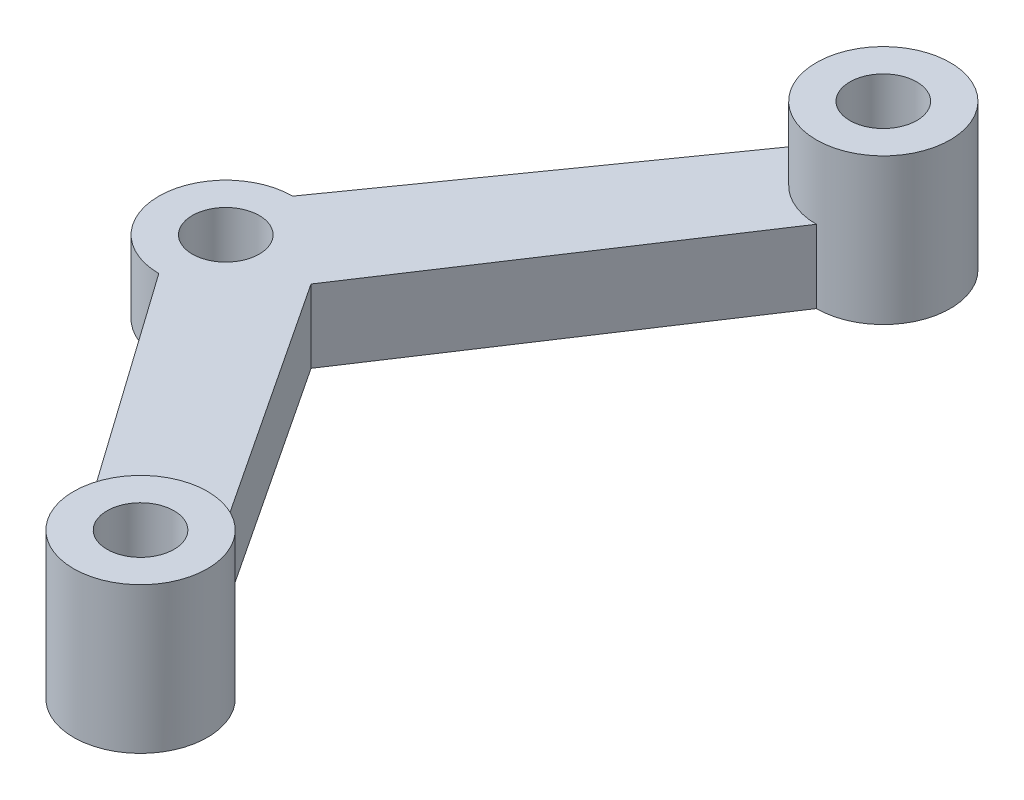
from build123d import *

# Parameters (mm, degrees)
SKETCH2_R           = 1.375
BOSS_EXTRUDE1_DEPTH = 3
SKETCH3_R           = 2.75
SKETCH3_R_2         = 1.375
BOSS_EXTRUDE2_DEPTH = 3


with BuildPart() as part:
    # Sketch2 → Boss-Extrude1 (new body)
    with BuildSketch(Plane(origin=(0, 0, 0), x_dir=(1, 0, 0), z_dir=(0, 1, 0))):
        with BuildLine():
            Line((-27, -2.75), (-17.987773433, -15.509030166))
            ThreePointArc((-17.987773433, -15.509030166), (-13.21593597, -17.100698117), (-15.25, -12.5))
            Line((-15.25, -12.5), (-23.5, 0))
            Line((-23.5, 0), (-15.25, 12.5))
            ThreePointArc((-15.25, 12.5), (-13.21593597, 17.100698117), (-17.987773433, 15.509030166))
            Line((-17.987773433, 15.509030166), (-27, 2.75))
            ThreePointArc((-27, 2.75), (-29.75, 0), (-27, -2.75))
        make_face()
        with Locations(Location((-27, 0, 0), (0, 0, 270))):
            Circle(SKETCH2_R, mode=Mode.SUBTRACT)
        with Locations(Location((-15.25, 15.25, 0), (0, 0, 270))):
            Circle(SKETCH2_R, mode=Mode.SUBTRACT)
        with Locations(Location((-15.25, -15.25, 0), (0, 0, 270))):
            Circle(SKETCH2_R, mode=Mode.SUBTRACT)
    extrude(amount=BOSS_EXTRUDE1_DEPTH)

    # Sketch3 → Boss-Extrude2 (add)
    # profile 1 of 2: a face of its own
    with BuildSketch(Plane(origin=(0, 3, 0), x_dir=(1, 0, 0), z_dir=(0, 1, 0))):
        with Locations(Location((-15.25, 15.25, 0), (0, 0, 270))):
            Circle(SKETCH3_R)
        with Locations(Location((-15.25, 15.25, 0), (0, 0, 270))):
            Circle(SKETCH3_R_2, mode=Mode.SUBTRACT)
    # profile 2 of 2: a face of its own
    with BuildSketch(Plane(origin=(0, 3, 0), x_dir=(1, 0, 0), z_dir=(0, 1, 0))):
        with Locations(Location((-15.25, -15.25, 0), (0, 0, 90))):
            Circle(SKETCH3_R)
        with Locations(Location((-15.25, -15.25, 0), (0, 0, 270))):
            Circle(SKETCH3_R_2, mode=Mode.SUBTRACT)
    extrude(amount=BOSS_EXTRUDE2_DEPTH)


solid = part.part
